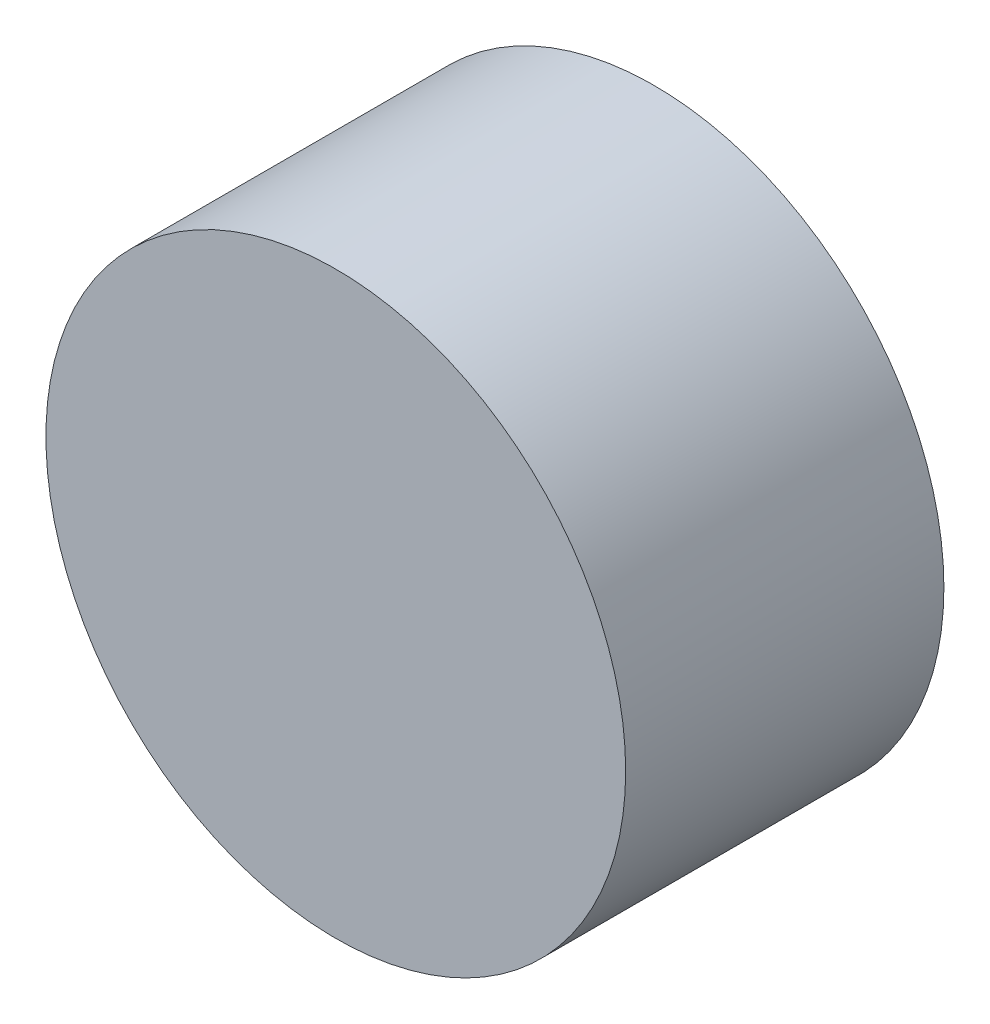
from build123d import *

# Parameters (mm, degrees)
IZIM1_R                     = 2.25
Y_KSEKLIK_EKSTR_ZYON1_DEPTH = 2.47


with BuildPart() as part:
    # Çizim1 → Yükseklik-Ekstrüzyon1 (new body)
    with BuildSketch(Plane.XY):
        Circle(IZIM1_R)
    extrude(amount=Y_KSEKLIK_EKSTR_ZYON1_DEPTH)


solid = part.part
